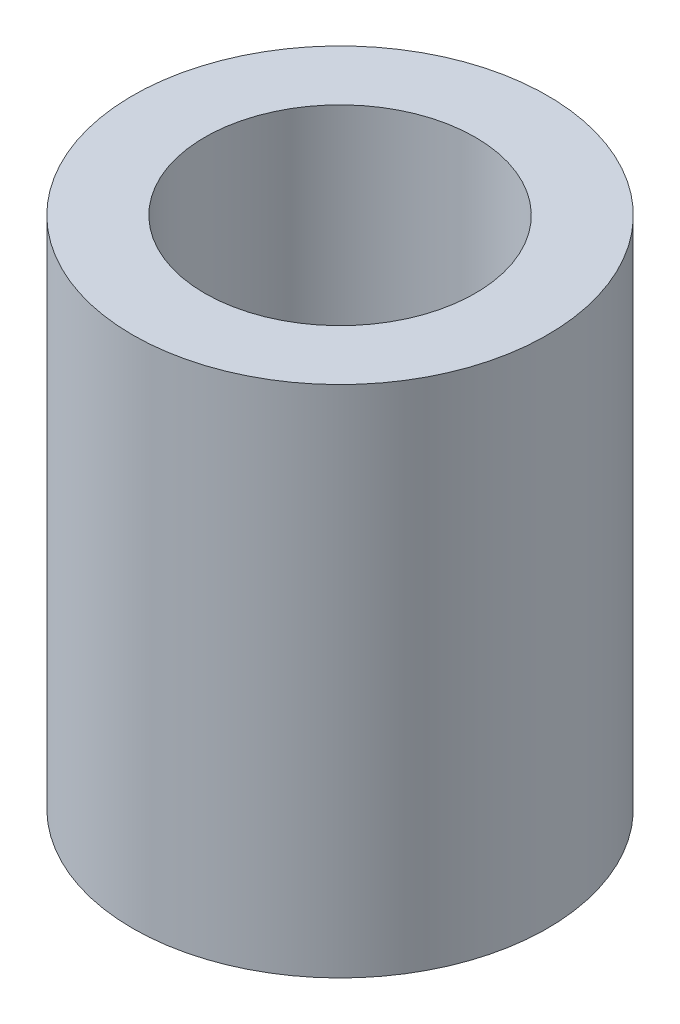
from build123d import *

# Parameters (mm, degrees)
SKETCH1_R           = 2.3
SKETCH1_R_2         = 1.5
BOSS_EXTRUDE1_DEPTH = 5.7


with BuildPart() as part:
    # Sketch1 → Boss-Extrude1 (new body)
    with BuildSketch(Plane(origin=(0, 0, 0), x_dir=(1, 0, 0), z_dir=(0, 1, 0))):
        with Locations(Location((0, 0, 0), (0, 0, 270))):
            Circle(SKETCH1_R)
        with Locations(Location((0, 0, 0), (0, 0, 270))):
            Circle(SKETCH1_R_2, mode=Mode.SUBTRACT)
    extrude(amount=BOSS_EXTRUDE1_DEPTH)


solid = part.part
